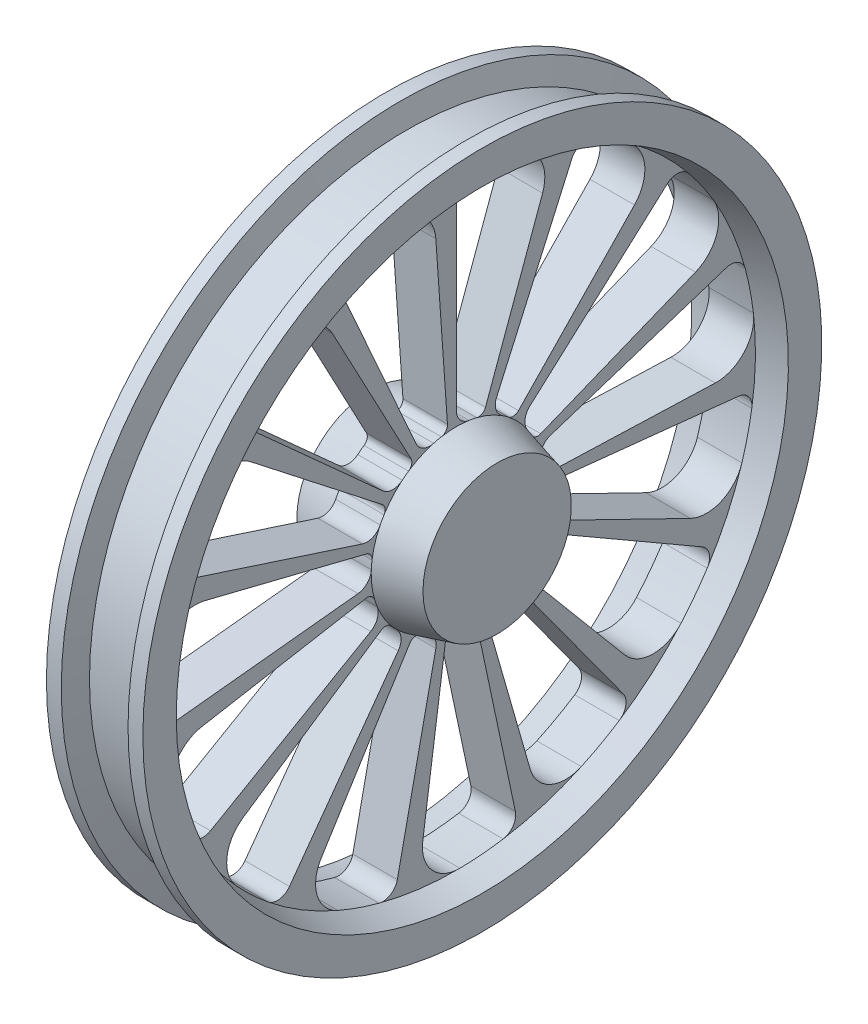
from build123d import *

# Parameters (mm, degrees)
CUT_EXTRUDE1_DEPTH = 658.143439441
CIRPATTERN1_COUNT  = 15


with BuildPart() as part:
    # Sketch1 → Revolve1 (revolve)
    with BuildSketch(Plane.XY, mode=Mode.PRIVATE) as revolve1_sk:
        Polygon((0, 0), (0, 100), (55, 114.737205584), (55, 403.121778265), (20, 412.5), (20, 457.5), (40, 457.5), (48.038475773, 427.5), (121.961524227, 427.5), (130, 457.5), (150, 457.5), (150, 412.5), (115, 403.121778265), (115, 114.737205584), (170, 100), (170, 0), align=None)
    revolve(revolve1_sk.sketch.rotate(Axis((0, 0, 0), (1, 0, 0)), 90), axis=Axis((0, 0, 0), (1, 0, 0)))

    # Sketch2 → Cut-Extrude1 (cut, through all)
    with BuildSketch(Plane(origin=(115, 0, 0), x_dir=(0, 0, -1), z_dir=(1, 0, 0))):
        with BuildLine():
            Line((0, 133.24456675), (0, 382.599394904))
            ThreePointArc((0, 382.599394904), (6.231940753, 397.105963918), (21.044054457, 402.57212507))
            ThreePointArc((21.044054457, 402.57212507), (50.181806454, 399.986192777), (79.055321782, 395.294098374))
            ThreePointArc((79.055321782, 395.294098374), (112.834045678, 370.768553377), (116.234563229, 329.163973992))
            Line((116.234563229, 329.163973992), (39.263817981, 117.688589464))
            ThreePointArc((39.263817981, 117.688589464), (34.572899054, 112.285328115), (27.472506583, 111.399675615))
            ThreePointArc((27.472506583, 111.399675615), (22.275857421, 112.55404267), (17.031258009, 113.46612973))
            ThreePointArc((17.031258009, 113.46612973), (4.844558076, 120.194180546), (0, 133.24456675))
        make_face()
    cut_extrude1 = extrude(amount=-CUT_EXTRUDE1_DEPTH, mode=Mode.SUBTRACT)

    # CirPattern1: Cut-Extrude1 ×15 about axis
    cirpattern1_axis = Axis((0, 0, 0), (1, 0, 0))
    for i in range(1, CIRPATTERN1_COUNT):
        add(cut_extrude1.rotate(cirpattern1_axis, i * 360 / CIRPATTERN1_COUNT), mode=Mode.SUBTRACT)


solid = part.part
